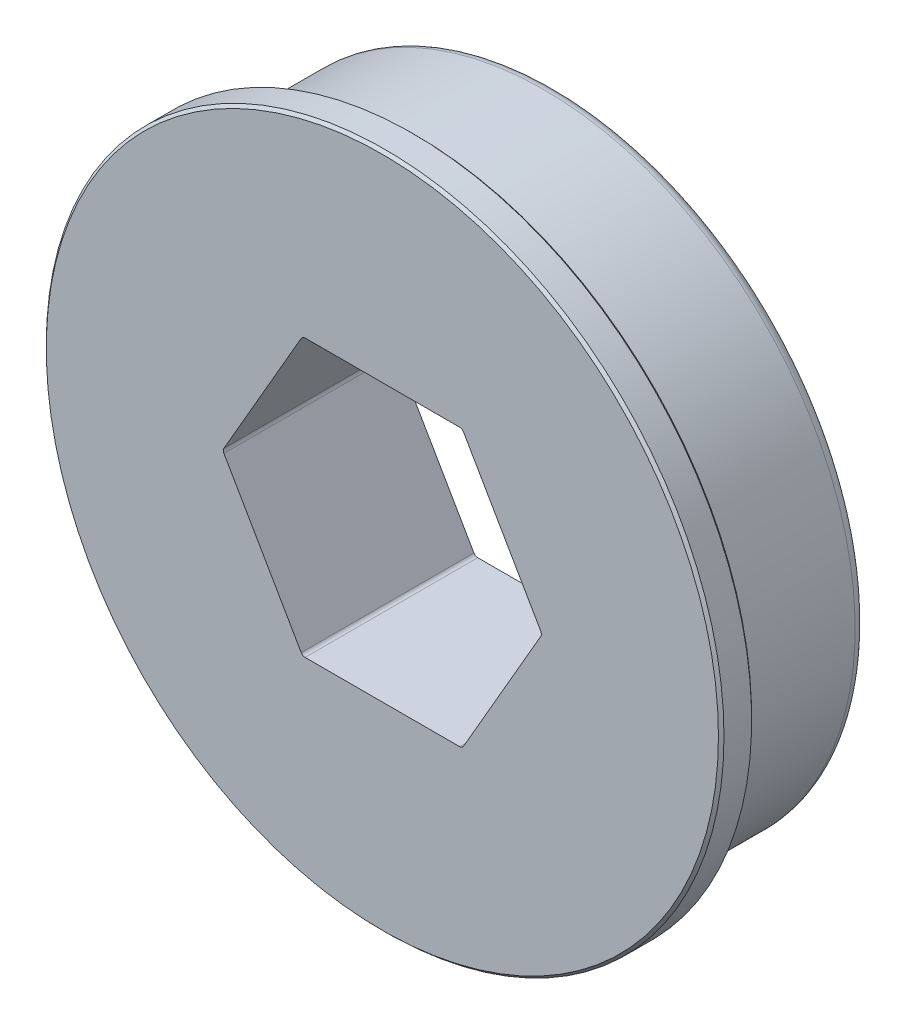
from build123d import *

# Parameters (mm, degrees)
CUT_EXTRUDE1_DEPTH = 24.386199605
CHAMFER1_SIZE      = 0.127
CHAMFER2_SIZE      = 0.127
FILLET1_R          = 0.508
FILLET2_R          = 0.2032


with BuildPart() as part:
    # Sketch1 → Revolve1 (revolve)
    with BuildSketch(Plane.XZ, mode=Mode.PRIVATE) as revolve1_sk:
        Polygon((15.5575, 7.92734), (0, 7.92734), (0, 0), (14.2875, 0), (14.2875, 5.89534), (13.97, 5.89534), (13.97, 6.40334), (15.5575, 6.40334), align=None)
    revolve(revolve1_sk.sketch.rotate(Axis((0, 0, 7.92734), (0, 0, -1)), 180), axis=Axis((0, 0, 7.92734), (0, 0, -1)))

    # Sketch2 → Cut-Extrude1 (cut, through all)
    with BuildSketch(Plane(origin=(0, 0, 0), x_dir=(-1, 0, 0), z_dir=(0, 0, -1))):
        Polygon((3.666174209, 6.35), (-3.666174209, 6.35), (-7.332348419, 0), (-3.666174209, -6.35), (3.666174209, -6.35), (7.332348419, 0), align=None)
    extrude(amount=-CUT_EXTRUDE1_DEPTH, mode=Mode.SUBTRACT)

    # Chamfer1
    chamfer1_edges = [part.edges().sort_by_distance(p)[0] for p in [
        (15.5575, 0, 6.40334),
    ]]
    chamfer(chamfer1_edges, length=CHAMFER1_SIZE)

    # Chamfer2
    chamfer2_edges = [part.edges().sort_by_distance(p)[0] for p in [
        (15.5575, 0, 7.92734),
    ]]
    chamfer(chamfer2_edges, length=CHAMFER2_SIZE)

    # Fillet1
    fillet1_edges = [part.edges().sort_by_distance(p)[0] for p in [
        (14.2875, 0, 0),
    ]]
    fillet(fillet1_edges, radius=FILLET1_R)

    # Fillet2
    fillet2_edges = [part.edges().sort_by_distance(p)[0] for p in [
        (-3.666174209, 6.35, 3.96367),
        (-7.332348419, 0, 3.96367),
        (-3.666174209, -6.35, 3.96367),
        (3.666174209, -6.35, 3.96367),
        (7.332348419, 0, 3.96367),
        (3.666174209, 6.35, 3.96367),
    ]]
    fillet(fillet2_edges, radius=FILLET2_R)


solid = part.part
